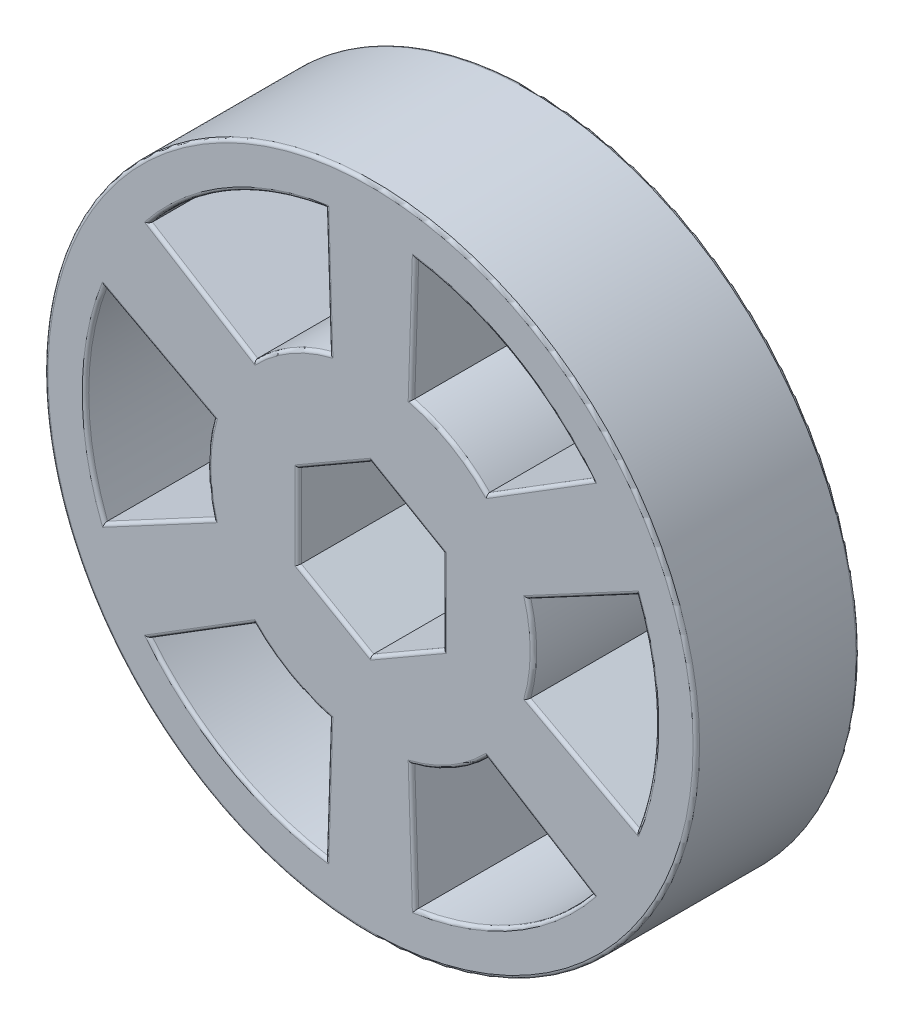
from build123d import *

# Parameters (mm, degrees)
SKETCH1_R           = 25.4
BOSS_EXTRUDE1_DEPTH = 6.35
CUT_EXTRUDE1_DEPTH  = 39.1
CUT_EXTRUDE2_DEPTH  = 39.1
FILLET2_R           = 0.254
FILLET3_R           = 0.254


with BuildPart() as part:
    # Sketch1 → Boss-Extrude1 (new, symmetric)
    with BuildSketch(Plane.XY):
        Circle(SKETCH1_R)
    extrude(amount=BOSS_EXTRUDE1_DEPTH, both=True)

    # Sketch2 → Cut-Extrude1 (cut, through all)
    with BuildSketch(Plane.XY.offset(6.35)):
        Polygon((-5.6515, 3.262895046), (-5.6515, -3.262895046), (0, -6.525790093), (5.6515, -3.262895046), (5.6515, 3.262895046), (0, 6.525790093), align=None)
    extrude(amount=-CUT_EXTRUDE1_DEPTH, mode=Mode.SUBTRACT)

    # Sketch3 → Cut-Extrude2 (cut, through all)
    with BuildSketch(Plane.XY.offset(6.35)):
        with BuildLine():
            Line((9.048699643, -8.911286932), (17.253704752, -14.009293249))
            ThreePointArc((17.253704752, -14.009293249), (11.1125, -19.247414599), (3.505551467, -21.946793249))
            Line((3.505551467, -21.946793249), (3.193051042, -12.292047227))
            ThreePointArc((3.193051042, -12.292047227), (6.35, -10.998522628), (9.048699643, -8.911286932))
        make_face()
        with BuildLine():
            Line((12.241750685, 3.380760296), (20.759256219, 7.9375))
            ThreePointArc((20.759256219, 7.9375), (22.225, 0), (20.759256219, -7.9375))
            Line((20.759256219, -7.9375), (12.241750685, -3.380760296))
            ThreePointArc((12.241750685, -3.380760296), (12.7, 0), (12.241750685, 3.380760296))
        make_face()
        with BuildLine():
            Line((-3.193051042, -12.292047227), (-3.505551467, -21.946793249))
            ThreePointArc((-3.505551467, -21.946793249), (-11.1125, -19.247414599), (-17.253704752, -14.009293249))
            Line((-17.253704752, -14.009293249), (-9.048699643, -8.911286932))
            ThreePointArc((-9.048699643, -8.911286932), (-6.35, -10.998522628), (-3.193051042, -12.292047227))
        make_face()
        with BuildLine():
            Line((-12.241750685, -3.380760296), (-20.759256219, -7.9375))
            ThreePointArc((-20.759256219, -7.9375), (-22.225, 0), (-20.759256219, 7.9375))
            Line((-20.759256219, 7.9375), (-12.241750685, 3.380760296))
            ThreePointArc((-12.241750685, 3.380760296), (-12.7, 0), (-12.241750685, -3.380760296))
        make_face()
        with BuildLine():
            Line((-9.048699643, 8.911286932), (-17.253704752, 14.009293249))
            ThreePointArc((-17.253704752, 14.009293249), (-11.1125, 19.247414599), (-3.505551467, 21.946793249))
            Line((-3.505551467, 21.946793249), (-3.193051042, 12.292047227))
            ThreePointArc((-3.193051042, 12.292047227), (-6.35, 10.998522628), (-9.048699643, 8.911286932))
        make_face()
        with BuildLine():
            Line((3.193051042, 12.292047227), (3.505551467, 21.946793249))
            ThreePointArc((3.505551467, 21.946793249), (11.1125, 19.247414599), (17.253704752, 14.009293249))
            Line((17.253704752, 14.009293249), (9.048699643, 8.911286932))
            ThreePointArc((9.048699643, 8.911286932), (6.35, 10.998522628), (3.193051042, 12.292047227))
        make_face()
    extrude(amount=-CUT_EXTRUDE2_DEPTH, mode=Mode.SUBTRACT)

    # Fillet2
    fillet2_edges = [part.edges().sort_by_distance(p)[0] for p in [
        (-2.82575, 4.894342569, -6.35),
        (2.82575, 4.894342569, -6.35),
        (5.6515, 0, -6.35),
        (2.82575, -4.894342569, -6.35),
        (-2.82575, -4.894342569, -6.35),
        (-5.6515, 0, -6.35),
        (-25.4, 0, -6.35),
        (6.35, -10.998522628, -6.35),
        (13.151202197, -11.46029009, -6.35),
        (11.1125, -19.247414599, -6.35),
        (3.349301254, -17.119420238, -6.35),
        (-6.35, -10.998522628, -6.35),
        (-3.349301254, -17.119420238, -6.35),
        (-11.1125, -19.247414599, -6.35),
        (-13.151202197, -11.46029009, -6.35),
        (-12.7, 0, -6.35),
        (-16.500503452, -5.659130148, -6.35),
        (-22.225, 0, -6.35),
        (-16.500503452, 5.659130148, -6.35),
        (-6.35, 10.998522628, -6.35),
        (-13.151202197, 11.46029009, -6.35),
        (-11.1125, 19.247414599, -6.35),
        (-3.349301254, 17.119420238, -6.35),
        (6.35, 10.998522628, -6.35),
        (3.349301254, 17.119420238, -6.35),
        (11.1125, 19.247414599, -6.35),
        (13.151202197, 11.46029009, -6.35),
        (12.7, 0, -6.35),
        (16.500503452, 5.659130148, -6.35),
        (22.225, 0, -6.35),
        (16.500503452, -5.659130148, -6.35),
    ]]
    fillet(fillet2_edges, radius=FILLET2_R)

    # Fillet3
    fillet3_edges = [part.edges().sort_by_distance(p)[0] for p in [
        (-2.82575, 4.894342569, 6.35),
        (-5.6515, 0, 6.35),
        (-2.82575, -4.894342569, 6.35),
        (2.82575, -4.894342569, 6.35),
        (5.6515, 0, 6.35),
        (2.82575, 4.894342569, 6.35),
        (-25.4, 0, 6.35),
        (6.35, -10.998522628, 6.35),
        (3.349301254, -17.119420238, 6.35),
        (11.1125, -19.247414599, 6.35),
        (13.151202197, -11.46029009, 6.35),
        (-6.35, -10.998522628, 6.35),
        (-13.151202197, -11.46029009, 6.35),
        (-11.1125, -19.247414599, 6.35),
        (-3.349301254, -17.119420238, 6.35),
        (-12.7, 0, 6.35),
        (-16.500503452, 5.659130148, 6.35),
        (-22.225, 0, 6.35),
        (-16.500503452, -5.659130148, 6.35),
        (-6.35, 10.998522628, 6.35),
        (-3.349301254, 17.119420238, 6.35),
        (-11.1125, 19.247414599, 6.35),
        (-13.151202197, 11.46029009, 6.35),
        (6.35, 10.998522628, 6.35),
        (13.151202197, 11.46029009, 6.35),
        (11.1125, 19.247414599, 6.35),
        (3.349301254, 17.119420238, 6.35),
        (12.7, 0, 6.35),
        (16.500503452, -5.659130148, 6.35),
        (22.225, 0, 6.35),
        (16.500503452, 5.659130148, 6.35),
    ]]
    fillet(fillet3_edges, radius=FILLET3_R)


solid = part.part
